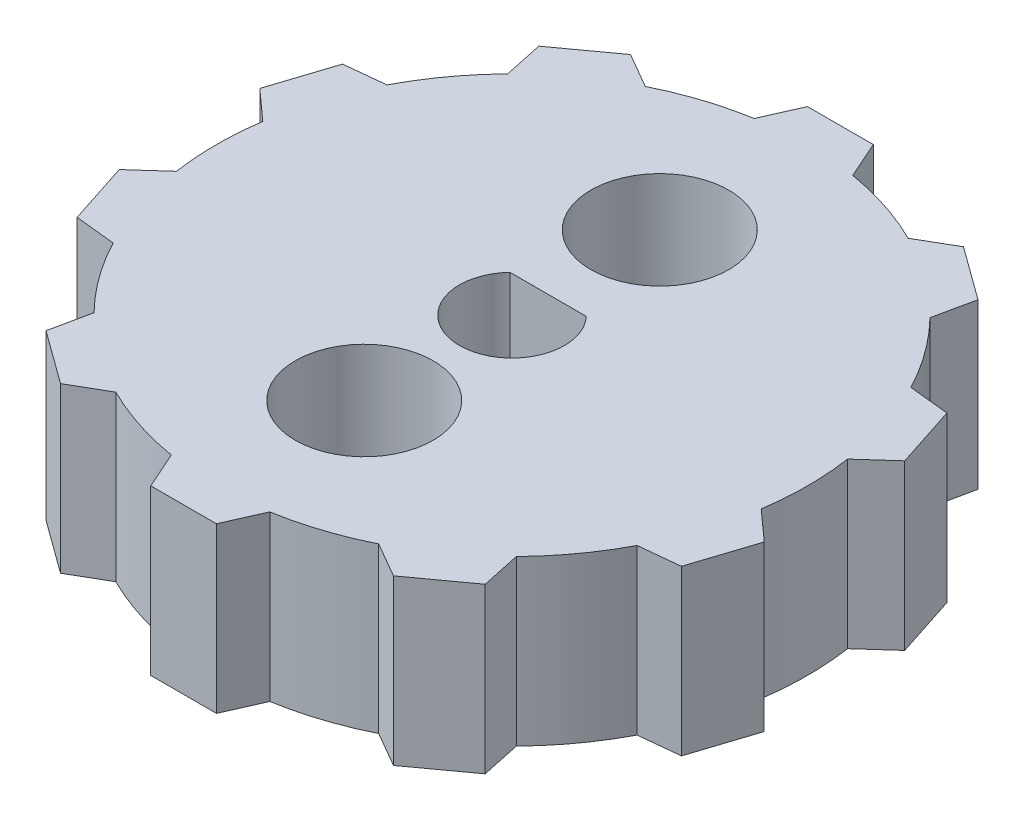
from build123d import *

# Parameters (mm, degrees)
SKETCH_1_R               = 9
EXTRUDE_1_DEPTH          = 5
EXTRUDE_START            = -5
EXTRUDE_2_DEPTH          = 5
PATTERN_CIRCULAR_1_COUNT = 10
CUT_EXTRUDE_1_REACH      = 16.88
SKETCH_3_R               = 2.1


with BuildPart() as part:
    # 草图1 → 凸台-拉伸1 (new body)
    with BuildSketch(Plane(origin=(0, 0, 0), x_dir=(1, 0, 0), z_dir=(0, 1, 0))):
        with Locations(Location((0, 0, 0), (0, 0, 270))):
            Circle(SKETCH_1_R)
        with BuildLine():
            Line((-1.161895004, 1.1), (1.161895004, 1.1))
            ThreePointArc((1.161895004, 1.1), (0, -1.6), (-1.161895004, 1.1))
        make_face(mode=Mode.SUBTRACT)
    extrude(amount=EXTRUDE_1_DEPTH)

    # 草图2 → 凸台-拉伸2 (add)
    with BuildSketch(Plane(origin=(0, 5, 0), x_dir=(1, 0, 0), z_dir=(0, 1, 0)).offset(EXTRUDE_START)):
        with BuildLine():
            Line((1.5, 8.874119675), (1, 10))
            Line((1, 10), (-1, 10))
            Line((-1, 10), (-1.5, 8.874119675))
            ThreePointArc((-1.5, 8.874119675), (0, 9), (1.5, 8.874119675))
        make_face()
    extrude_2 = extrude(amount=EXTRUDE_2_DEPTH)

    # 阵列(圆周)1: 凸台-拉伸2 ×10 about axis
    pattern_circular_1_axis = Axis((0, 0, 0), (0, 1, 0))
    for i in range(1, PATTERN_CIRCULAR_1_COUNT):
        add(extrude_2.rotate(pattern_circular_1_axis, i * 360 / PATTERN_CIRCULAR_1_COUNT))

    # 草图3 → 切除-拉伸1 (cut, up to next)
    with BuildSketch(Plane(origin=(0, 5, 0), x_dir=(1, 0, 0), z_dir=(0, 1, 0)), mode=Mode.PRIVATE) as cut_extrude_1_sk1:
        with Locations(Location((0, 4.5, 0), (0, 0, 270))):
            Circle(SKETCH_3_R)
    cut_extrude_1_tool1 = extrude(cut_extrude_1_sk1.sketch, amount=-CUT_EXTRUDE_1_REACH, mode=Mode.PRIVATE) & part.part
    # 草图3 → 切除-拉伸1 (cut, up to next)
    with BuildSketch(Plane(origin=(0, 5, 0), x_dir=(1, 0, 0), z_dir=(0, 1, 0)), mode=Mode.PRIVATE) as cut_extrude_1_sk2:
        with Locations(Location((0, -4.5, 0), (0, 0, 270))):
            Circle(SKETCH_3_R)
    cut_extrude_1_tool2 = extrude(cut_extrude_1_sk2.sketch, amount=-CUT_EXTRUDE_1_REACH, mode=Mode.PRIVATE) & part.part
    add(cut_extrude_1_tool1.solids().sort_by_distance((0, 5, -4.5))[0], mode=Mode.SUBTRACT)
    add(cut_extrude_1_tool2.solids().sort_by_distance((0, 5, 4.5))[0], mode=Mode.SUBTRACT)


solid = part.part
